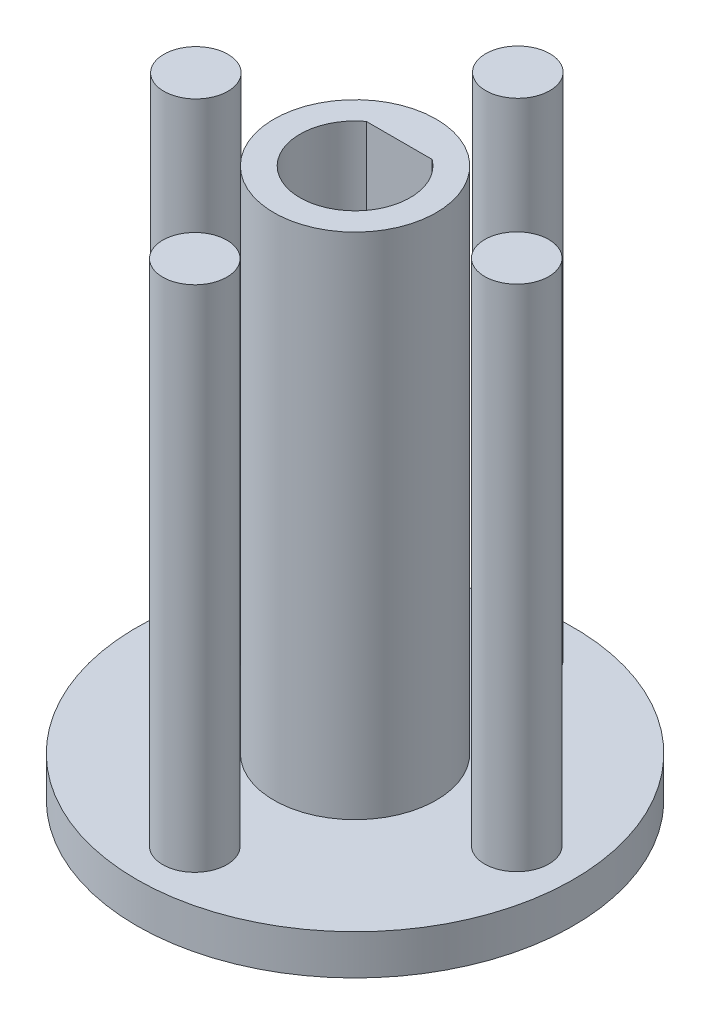
from build123d import *

# Parameters (mm, degrees)
SKETCH3_R             = 1.6
BOSS_EXTRUDE1_DEPTH   = 27.4
BOSS_EXTRUDE1_2_DEPTH = 27.4
BOSS_EXTRUDE1_3_DEPTH = 27.4
BOSS_EXTRUDE1_4_DEPTH = 27.4
SKETCH3_R_2           = 4.05
BOSS_EXTRUDE1_5_DEPTH = 27.4
SKETCH3_17_R          = 10.9
BOSS_EXTRUDE2_DEPTH   = 2


with BuildPart() as part:
    # Sketch3 → Boss-Extrude1 (new body)
    with BuildSketch(Plane(origin=(0, 0, 0), x_dir=(1, 0, 0), z_dir=(0, 1, 0))):
        with Locations((0.009034474, 8.115584077)):
            Circle(SKETCH3_R)
    extrude(amount=BOSS_EXTRUDE1_DEPTH)



with BuildPart() as body_2:
    # Sketch3 → Boss-Extrude1 2 (new body)
    with BuildSketch(Plane(origin=(0, 0, 0), x_dir=(1, 0, 0), z_dir=(0, 1, 0))):
        with Locations((8.017679827, 0.053335715)):
            Circle(SKETCH3_R)
    extrude(amount=BOSS_EXTRUDE1_2_DEPTH)


with BuildPart() as body_3:
    # Sketch3 → Boss-Extrude1 3 (new body)
    with BuildSketch(Plane(origin=(0, 0, 0), x_dir=(1, 0, 0), z_dir=(0, 1, 0))):
        with Locations((0.009179949, -8.009057152)):
            Circle(SKETCH3_R)
    extrude(amount=BOSS_EXTRUDE1_3_DEPTH)


with BuildPart() as body_4:
    # Sketch3 → Boss-Extrude1 4 (new body)
    with BuildSketch(Plane(origin=(0, 0, 0), x_dir=(1, 0, 0), z_dir=(0, 1, 0))):
        with Locations((-7.999465404, 0.05319121)):
            Circle(SKETCH3_R)
    extrude(amount=BOSS_EXTRUDE1_4_DEPTH)


with BuildPart() as body_5:
    # Sketch3 → Boss-Extrude1 5 (new body)
    with BuildSketch(Plane(origin=(0, 0, 0), x_dir=(1, 0, 0), z_dir=(0, 1, 0))):
        Circle(SKETCH3_R_2)
        with BuildLine():
            Line((-1.643777195, 2.204653382), (1.643777195, 2.204653382))
            ThreePointArc((1.643777195, 2.204653382), (0, -2.75), (-1.643777195, 2.204653382))
        make_face(mode=Mode.SUBTRACT)
    extrude(amount=BOSS_EXTRUDE1_5_DEPTH)


with BuildPart() as part_1:
    add(part.part)

    add(body_2.part)  # Boss-Extrude2 merges body 2

    add(body_3.part)  # Boss-Extrude2 merges body 3

    add(body_4.part)  # Boss-Extrude2 merges body 4

    add(body_5.part)  # Boss-Extrude2 merges body 5
    # Sketch3<17> → Boss-Extrude2 (add)
    with BuildSketch(Plane(origin=(0, 0, 0), x_dir=(1, 0, 0), z_dir=(0, 1, 0))):
        Circle(SKETCH3_17_R)
    extrude(amount=BOSS_EXTRUDE2_DEPTH)


solid = part_1.part
